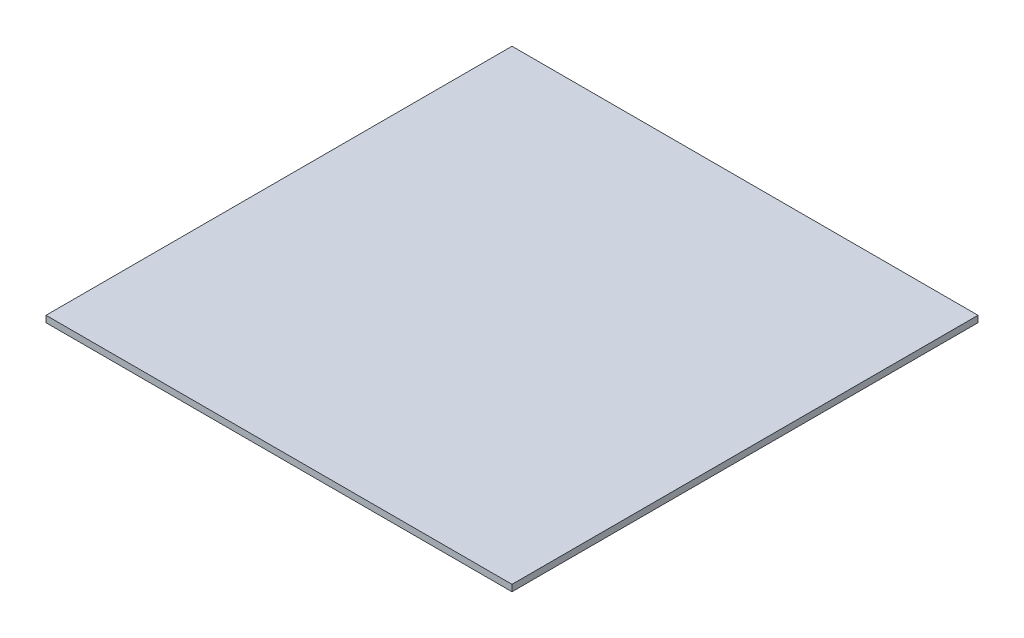
from build123d import *

# Parameters (mm, degrees)
SKETCH1_W           = 1828.8
SKETCH1_H           = 1828.8
BOSS_EXTRUDE1_DEPTH = 25.4


with BuildPart() as part:
    # Sketch1 → Boss-Extrude1 (new body)
    with BuildSketch(Plane(origin=(0, 0, 0), x_dir=(1, 0, 0), z_dir=(0, 1, 0))):
        Rectangle(SKETCH1_W, SKETCH1_H)
    extrude(amount=-BOSS_EXTRUDE1_DEPTH)


solid = part.part
